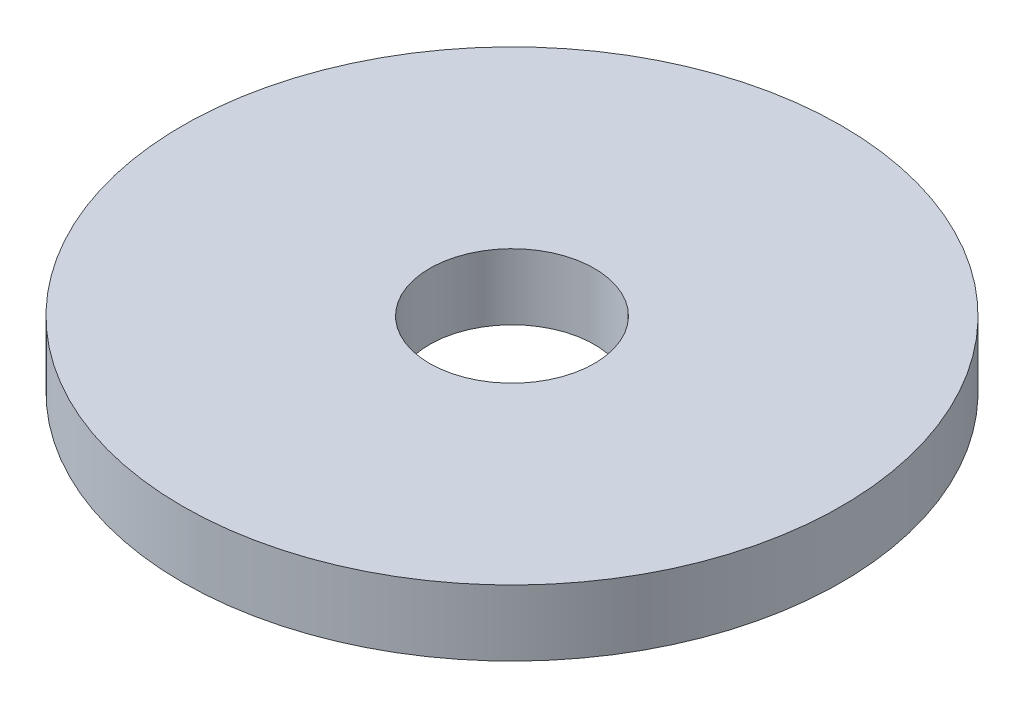
from build123d import *

# Parameters (mm, degrees)
SKETCH2_R           = 10
SKETCH2_R_2         = 2.5
BOSS_EXTRUDE1_DEPTH = 2


with BuildPart() as part:
    # Sketch2 → Boss-Extrude1 (new body)
    with BuildSketch(Plane(origin=(0, 0, 0), x_dir=(1, 0, 0), z_dir=(0, 1, 0))):
        with Locations(Location((0, 0, 0), (0, 0, 270))):
            Circle(SKETCH2_R)
        with Locations(Location((0, 0, 0), (0, 0, 270))):
            Circle(SKETCH2_R_2, mode=Mode.SUBTRACT)
    extrude(amount=BOSS_EXTRUDE1_DEPTH)


solid = part.part
